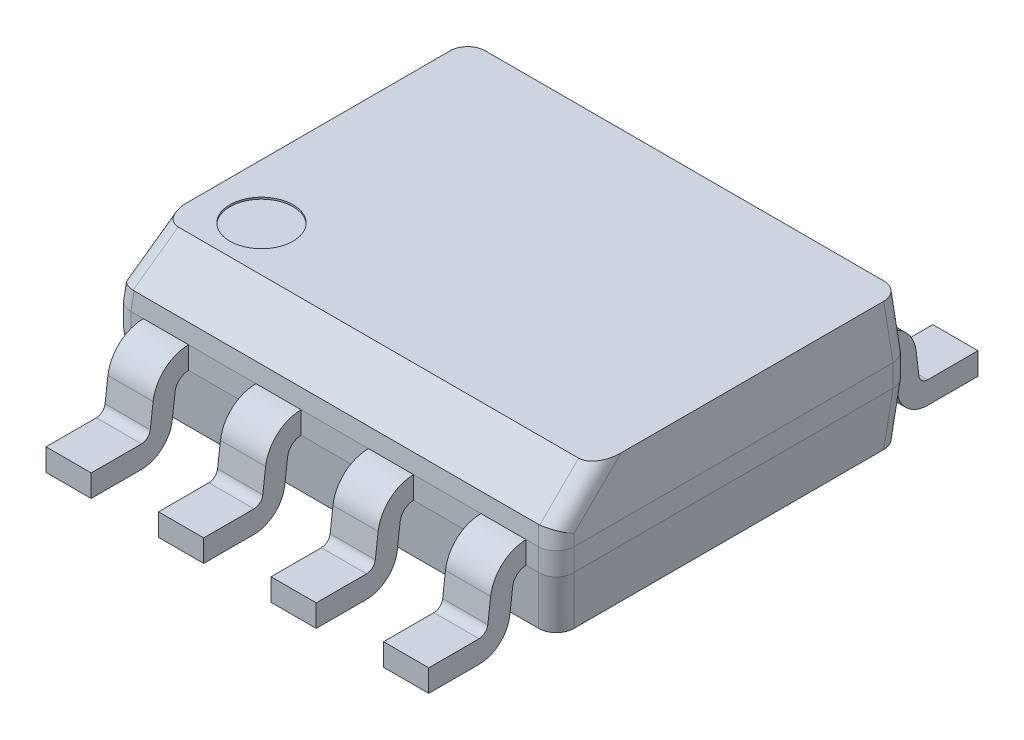
from build123d import *

# Parameters (mm, degrees)
BOSS_EXTRUDE1_DEPTH      = 0.125
BOSS_EXTRUDE1_DEPTH_BACK = 0.125
SKETCH1_W                = 5
SKETCH1_H                = 4
SKETCH2_W                = 5
SKETCH2_H                = 4
BOSS_EXTRUDE2_DEPTH      = 0.6
BOSS_EXTRUDE2_TAPER      = 5
SKETCH3_W                = 5
SKETCH3_H                = 4
BOSS_EXTRUDE3_DEPTH      = 0.6
BOSS_EXTRUDE3_TAPER      = 5
CHAMFER1_SIZE            = 0.4
CHAMFER1_SIZE2           = 0.440025147
BOSS_EXTRUDE4_START      = 0.38
BOSS_EXTRUDE4_DEPTH      = 0.51
LPATTERN1_COUNT          = 2
LPATTERN1_PITCH          = 1.27
LPATTERN1_COL_COUNT      = 3
LPATTERN1_COL_PITCH      = 1.27
SKETCH6_R                = 0.356697025
CUT_EXTRUDE1_DEPTH       = 0.02
FILLET_1_R               = 0.2
SKETCH_1_W               = 3.1
SKETCH_1_H               = 2.2
EXTRUDE_1_DEPTH          = 0.01
CUT_EXTRUDE2_DEPTH       = 0.01


with BuildPart() as part:
    # Sketch1 → Boss-Extrude1 (new, two sides: drawn at the far end of the back side and taken through both)
    with BuildSketch(Plane(origin=(0, 0.82, 0), x_dir=(1, 0, 0), z_dir=(0, 1, 0)).offset(-BOSS_EXTRUDE1_DEPTH_BACK)):
        Rectangle(SKETCH1_W, SKETCH1_H)
    extrude(amount=BOSS_EXTRUDE1_DEPTH + BOSS_EXTRUDE1_DEPTH_BACK)

    # Sketch2 → Boss-Extrude2 (add)
    with BuildSketch(Plane(origin=(0, 0.945, 0), x_dir=(1, 0, 0), z_dir=(0, 1, 0))):
        Rectangle(SKETCH2_W, SKETCH2_H)
    extrude(amount=BOSS_EXTRUDE2_DEPTH, taper=BOSS_EXTRUDE2_TAPER)

    # Sketch3 → Boss-Extrude3 (add)
    with BuildSketch(Plane.XZ.offset(-0.695)):
        Rectangle(SKETCH3_W, SKETCH3_H)
    extrude(amount=BOSS_EXTRUDE3_DEPTH, taper=BOSS_EXTRUDE3_TAPER)

    # Chamfer1
    chamfer1_edges = [part.edges().sort_by_distance(p)[0] for p in [
        (0, 1.545, 1.947506802),
    ]]
    chamfer1_side = [part.faces().sort_by_distance(p)[0] for p in [
        (0, 1.243938997, 1.973846227),
    ]]
    chamfer(chamfer1_edges, length=CHAMFER1_SIZE, length2=CHAMFER1_SIZE2, reference=chamfer1_side[0])

    # Sketch5 → Boss-Extrude4 (add)
    with BuildSketch(Plane(origin=(0, 0, 0), x_dir=(0, 0, -1), z_dir=(1, 0, 0)).offset(BOSS_EXTRUDE4_START)):
        with BuildLine():
            Line((2.43285762, 0.329963507), (2.400847843, 0.590403282))
            ThreePointArc((2.400847843, 0.590403282), (2.267590241, 0.843628667), (2, 0.945))
            Line((2, 0.945), (2, 0.695))
            ThreePointArc((2, 0.695), (2.101946488, 0.656379776), (2.152714971, 0.559906105))
            Line((2.152714971, 0.559906105), (2.184724748, 0.299466331))
            ThreePointArc((2.184724748, 0.299466331), (2.300209515, 0.080013931), (2.532110769, -0.007837622))
            Line((2.532110769, -0.007837622), (3.099630301, -0.007837622))
            Line((3.099630301, -0.007837622), (3.099630301, 0.242162378))
            Line((3.099630301, 0.242162378), (2.532110769, 0.242162378))
            ThreePointArc((2.532110769, 0.242162378), (2.465853268, 0.267262822), (2.43285762, 0.329963507))
        make_face()
        with BuildLine():
            ThreePointArc((-2.152714971, 0.559906105), (-2.101946488, 0.656379776), (-2, 0.695))
            Line((-2, 0.695), (-2, 0.945))
            ThreePointArc((-2, 0.945), (-2.267590241, 0.843628667), (-2.400847843, 0.590403282))
            Line((-2.400847843, 0.590403282), (-2.43285762, 0.329963507))
            ThreePointArc((-2.43285762, 0.329963507), (-2.465853268, 0.267262822), (-2.532110769, 0.242162378))
            Line((-2.532110769, 0.242162378), (-3.099630301, 0.242162378))
            Line((-3.099630301, 0.242162378), (-3.099630301, -0.007837622))
            Line((-3.099630301, -0.007837622), (-2.532110769, -0.007837622))
            ThreePointArc((-2.532110769, -0.007837622), (-2.300209515, 0.080013931), (-2.184724748, 0.299466331))
            Line((-2.184724748, 0.299466331), (-2.152714971, 0.559906105))
        make_face()
    boss_extrude4 = extrude(amount=BOSS_EXTRUDE4_DEPTH)

    # LPattern1: Boss-Extrude4 ×2
    with Locations(*[(i * LPATTERN1_PITCH, 0, 0) for i in range(1, LPATTERN1_COUNT)]):
        add(boss_extrude4)

    # LPattern1 col: Boss-Extrude4 ×3
    with Locations(*[(-i * LPATTERN1_COL_PITCH, 0, 0) for i in range(1, LPATTERN1_COL_COUNT)]):
        add(boss_extrude4)

    # Sketch6 → Cut-Extrude1 (cut)
    with BuildSketch(Plane(origin=(0, 1.545, 0), x_dir=(1, 0, 0), z_dir=(0, 1, 0))):
        with Locations(Location((-1.829466097, -0.997890598, 0), (0, 0, 270))):
            Circle(SKETCH6_R)
    extrude(amount=-CUT_EXTRUDE1_DEPTH, mode=Mode.SUBTRACT)

    # Скругление1
    fillet_1_edges = [part.edges().sort_by_distance(p)[0] for p in [
        (-2.33, 0.945, 2),
        (2.33, 0.695, -2),
        (2.33, 0.945, -2),
        (2.473753401, 1.245, -1.973753401),
        (-2.473753401, 1.245, -1.973753401),
        (2.473753401, 0.395, 1.973753401),
        (-2.473753401, 0.395, 1.973753401),
        (-2.473753401, 0.395, -1.973753401),
        (2.473753401, 0.395, -1.973753401),
        (2.491184549, 1.04576106, 1.991184549),
        (2.46493795, 1.34576106, 1.744925377),
        (-2.491184549, 1.04576106, 1.991184549),
        (-2.46493795, 1.34576106, 1.744925377),
        (-2.33, 0.695, 2),
        (-2.5, 0.82, -2),
        (2.5, 0.82, -2),
        (2.5, 0.82, 2),
        (-2.5, 0.82, 2),
    ]]
    fillet(fillet_1_edges, radius=FILLET_1_R)

    # Эскиз1 → Бобышка-Вытянуть1 (add)
    with BuildSketch(Plane.XZ.offset(-0.095)):
        Rectangle(SKETCH_1_W, SKETCH_1_H)
    extrude(amount=EXTRUDE_1_DEPTH)

    # Sketch7 → Cut-Extrude2 (cut)
    # profile 1 of 3: a face of its own
    with BuildSketch(Plane(origin=(0, 1.745, 0), x_dir=(1, 0, 0), z_dir=(0, 1, 0))):
        with BuildLine():
            Line((-1.226287299, -0.23455359), (-1.141752043, -0.1838725))
            add(Edge.make_bspline(
                [(-1.141752043, -0.1838725), (-1.133889689, -0.197033753), (-1.118825723, -0.222250206), (-1.093696763, -0.256323932), (-1.067658789, -0.285284548), (-1.040518979, -0.308963579), (-1.012442994, -0.327606118), (-0.98324755, -0.340806755), (-0.953031033, -0.349039891), (-0.932467084, -0.350039916), (-0.92220076, -0.350539167)],
                knots=[0, 0, 0, 0, 1.272034388, 2.437168799, 3.508375237, 4.49857839, 5.41946034, 6.295179144, 7.148887113, 8, 8, 8, 8], degree=3))
            add(Edge.make_bspline(
                [(-0.92220076, -0.350539167), (-0.913433086, -0.350294975), (-0.896051151, -0.349810863), (-0.870461939, -0.345159206), (-0.845609995, -0.338012883), (-0.822007527, -0.327778331), (-0.799980209, -0.315395907), (-0.78066401, -0.300439856), (-0.763965121, -0.283695226), (-0.750305374, -0.265014467), (-0.739825363, -0.244923854), (-0.731770487, -0.224302153), (-0.727300466, -0.202825419), (-0.726627108, -0.188365287), (-0.726287299, -0.181068013)],
                knots=[0, 0, 0, 0, 1.095163259, 2.171163733, 3.241058638, 4.321873601, 5.38011039, 6.391990106, 7.366004449, 8.327778327, 9.272591725, 10.192022065, 11.087607919, 12, 12, 12, 12], degree=3))
            add(Edge.make_bspline(
                [(-0.726287299, -0.181068013), (-0.726708531, -0.172742056), (-0.727564833, -0.155816602), (-0.734802399, -0.130845273), (-0.746187898, -0.10613311), (-0.75669151, -0.090847034), (-0.762144671, -0.082910962)],
                knots=[0, 0, 0, 0, 0.938893495, 1.908633276, 2.914225137, 4, 4, 4, 4], degree=3))
            add(Edge.make_bspline(
                [(-0.762144671, -0.082910962), (-0.766621989, -0.077183298), (-0.776021559, -0.065158784), (-0.792180848, -0.047260145), (-0.811142595, -0.02879774), (-0.832257897, -0.009066581), (-0.856295922, 0.011015647), (-0.882503783, 0.032406583), (-0.9115506, 0.054292748), (-0.931921885, 0.068970624), (-0.942433132, 0.076544166)],
                knots=[0, 0, 0, 0, 0.722233717, 1.516239348, 2.393582979, 3.351407094, 4.387010283, 5.505090956, 6.712668013, 8, 8, 8, 8], degree=3))
            add(Edge.make_bspline(
                [(-0.942433132, 0.076544166), (-0.952954274, 0.084038048), (-0.973069896, 0.098365781), (-1.001200919, 0.119629862), (-1.02635648, 0.139070967), (-1.048424771, 0.156872114), (-1.067396084, 0.173035715), (-1.083419916, 0.187406555), (-1.096088075, 0.200373286), (-1.103132527, 0.208785098), (-1.106295312, 0.212561794)],
                knots=[0, 0, 0, 0, 1.452282411, 2.77665338, 3.964542531, 5.026858415, 5.96415736, 6.766646006, 7.446254459, 8, 8, 8, 8], degree=3))
            add(Edge.make_bspline(
                [(-1.106295312, 0.212561794), (-1.110716039, 0.218447805), (-1.119409992, 0.230023435), (-1.130885994, 0.248116251), (-1.14064004, 0.266637184), (-1.148286421, 0.285636003), (-1.154725341, 0.304845982), (-1.159056178, 0.324517767), (-1.161768006, 0.344563086), (-1.162045716, 0.358052658), (-1.162184735, 0.364805384)],
                knots=[0, 0, 0, 0, 1.068054152, 2.10047183, 3.106115577, 4.101338837, 5.06977816, 6.043150881, 7.020423561, 8, 8, 8, 8], degree=3))
            add(Edge.make_bspline(
                [(-1.162184735, 0.364805384), (-1.161811818, 0.37538532), (-1.161073955, 0.396319052), (-1.154833807, 0.42689929), (-1.144984409, 0.456095409), (-1.13118587, 0.483618361), (-1.113398055, 0.508751499), (-1.092813491, 0.531783924), (-1.068295923, 0.551146376), (-1.041395174, 0.568064107), (-1.011950496, 0.581305799), (-0.981095952, 0.591294651), (-0.948782503, 0.596954439), (-0.926895893, 0.597766657), (-0.915790504, 0.598178782)],
                knots=[0, 0, 0, 0, 1.005424448, 1.989358655, 2.955360095, 3.929531133, 4.905563448, 5.876582895, 6.856512386, 7.866279853, 8.892233794, 9.918561126, 10.94386622, 12, 12, 12, 12], degree=3))
            add(Edge.make_bspline(
                [(-0.915790504, 0.598178782), (-0.904006475, 0.597772338), (-0.880571803, 0.596964052), (-0.846100599, 0.589936186), (-0.812911823, 0.578307423), (-0.786213747, 0.565110663), (-0.765318673, 0.551930259), (-0.749383606, 0.539924595), (-0.733235763, 0.526103135), (-0.71674489, 0.510429065), (-0.700190416, 0.492758565), (-0.683326573, 0.473212654), (-0.666113924, 0.45191078), (-0.655040821, 0.43670378), (-0.649364222, 0.428907948)],
                knots=[0, 0, 0, 0, 1.286793592, 2.559021753, 3.825965368, 5.121522368, 5.803751409, 6.523245864, 7.299691795, 8.125521123, 9.008227632, 9.944561021, 10.946284179, 12, 12, 12, 12], degree=3))
            Line((-0.649364222, 0.428907948), (-0.73049403, 0.367409551))
            add(Edge.make_bspline(
                [(-0.73049403, 0.367409551), (-0.735392868, 0.373720605), (-0.744826884, 0.38587422), (-0.759149594, 0.402894596), (-0.772649208, 0.418442162), (-0.785949322, 0.431946484), (-0.798347503, 0.444147094), (-0.810380943, 0.454592739), (-0.821876472, 0.463385766), (-0.836367018, 0.47276964), (-0.854572081, 0.482071498), (-0.877424805, 0.489942663), (-0.901306598, 0.494672681), (-0.917572207, 0.495298078), (-0.92580653, 0.495614679)],
                knots=[0, 0, 0, 0, 1.181633172, 2.275549214, 3.290209073, 4.226197932, 5.078386478, 5.862611352, 6.581680152, 7.217281963, 8.414376989, 9.595101626, 10.782541182, 12, 12, 12, 12], degree=3))
            add(Edge.make_bspline(
                [(-0.92580653, 0.495614679), (-0.936136965, 0.495268479), (-0.956058235, 0.494600865), (-0.98434116, 0.487309441), (-1.009796567, 0.475828909), (-1.031668729, 0.459738915), (-1.049879293, 0.440675775), (-1.063052282, 0.418738959), (-1.0709809, 0.394515415), (-1.071948409, 0.377617799), (-1.072441145, 0.369012115)],
                knots=[0, 0, 0, 0, 1.14458467, 2.207223713, 3.21896685, 4.227309161, 5.202851033, 6.127160689, 7.046193047, 8, 8, 8, 8], degree=3))
            add(Edge.make_bspline(
                [(-1.072441145, 0.369012115), (-1.072328823, 0.36365455), (-1.072103996, 0.352930658), (-1.068968339, 0.337087395), (-1.06493996, 0.321284155), (-1.05855635, 0.305591989), (-1.049743407, 0.289736457), (-1.038170499, 0.273444532), (-1.023595267, 0.256572616), (-1.012430406, 0.24559908), (-1.006535696, 0.239805384)],
                knots=[0, 0, 0, 0, 0.858281714, 1.717966888, 2.583508476, 3.4729293, 4.427298488, 5.488583878, 6.674047936, 8, 8, 8, 8], degree=3))
            add(Edge.make_bspline(
                [(-1.006535696, 0.239805384), (-1.004346733, 0.237851948), (-0.999146256, 0.233211032), (-0.989638849, 0.225613237), (-0.977083764, 0.216241016), (-0.961808849, 0.20464464), (-0.94353246, 0.191192794), (-0.922252587, 0.176057476), (-0.898206435, 0.158747345), (-0.88114303, 0.146645191), (-0.872120632, 0.140246089)],
                knots=[0, 0, 0, 0, 0.420754252, 0.999615792, 1.744751191, 2.668019286, 3.750313428, 4.999500688, 6.413464383, 8, 8, 8, 8], degree=3))
            add(Edge.make_bspline(
                [(-0.872120632, 0.140246089), (-0.861267514, 0.132348558), (-0.840251955, 0.117056083), (-0.81034979, 0.094080175), (-0.783237273, 0.071609384), (-0.758819215, 0.04978721), (-0.736854384, 0.028779184), (-0.717586464, 0.008332561), (-0.700819126, -0.011406174), (-0.682767921, -0.036712625), (-0.66432283, -0.067792934), (-0.648482399, -0.105872431), (-0.6384943, -0.144099951), (-0.637188153, -0.169793333), (-0.636543709, -0.182470257)],
                knots=[0, 0, 0, 0, 1.163667725, 2.253281268, 3.268753668, 4.215851969, 5.092017293, 5.902905408, 6.650798638, 7.335211899, 8.59617414, 9.77448103, 10.901945474, 12, 12, 12, 12], degree=3))
            add(Edge.make_bspline(
                [(-0.636543709, -0.182470257), (-0.636731463, -0.191435504), (-0.637103324, -0.209191899), (-0.641377871, -0.235264778), (-0.647640633, -0.260587884), (-0.657079842, -0.284848202), (-0.668600745, -0.308489563), (-0.683219673, -0.33089182), (-0.700164725, -0.352550791), (-0.719602944, -0.372888931), (-0.740873202, -0.391559273), (-0.763354257, -0.408167576), (-0.787082907, -0.422015669), (-0.811930426, -0.433315909), (-0.837902522, -0.442154057), (-0.86499046, -0.448557734), (-0.893238892, -0.452487937), (-0.91243903, -0.452895869), (-0.92220076, -0.45310327)],
                knots=[0, 0, 0, 0, 0.983748083, 1.948392443, 2.894712957, 3.844097841, 4.80183111, 5.778335162, 6.776009319, 7.81870978, 8.863265674, 9.881300176, 10.883814829, 11.87499822, 12.874611388, 13.892143829, 14.928324115, 16, 16, 16, 16], degree=3))
            add(Edge.make_bspline(
                [(-0.92220076, -0.45310327), (-0.929753716, -0.452957218), (-0.944764504, -0.452666953), (-0.966967213, -0.450100873), (-0.988721382, -0.446470272), (-1.009754034, -0.440706252), (-1.030336151, -0.43371283), (-1.050378218, -0.425101878), (-1.069889948, -0.414782678), (-1.088980686, -0.402984099), (-1.107601879, -0.389253315), (-1.125578869, -0.373260887), (-1.143501494, -0.355447886), (-1.16084075, -0.335330582), (-1.177947363, -0.313233987), (-1.194484051, -0.288951363), (-1.210793113, -0.262614976), (-1.221026104, -0.244082095), (-1.226287299, -0.23455359)],
                knots=[0, 0, 0, 0, 0.915332311, 1.819136955, 2.706846663, 3.586547465, 4.459518054, 5.340707479, 6.227863349, 7.133153174, 8.059268498, 9.028702269, 10.047606654, 11.120612155, 12.245963614, 13.433783089, 14.680604001, 16, 16, 16, 16], degree=3))
        make_face()
    # profile 2 of 3: a face of its own
    with BuildSketch(Plane(origin=(0, 1.745, 0), x_dir=(1, 0, 0), z_dir=(0, 1, 0))):
        with BuildLine():
            add(Edge.make_bspline(
                [(0.036533214, 0.598178782), (0.055049816, 0.597709788), (0.091417949, 0.596788644), (0.14486792, 0.589737472), (0.19589509, 0.577538789), (0.24491513, 0.561292223), (0.291341694, 0.539619541), (0.335524235, 0.513423784), (0.377357627, 0.482430511), (0.416278022, 0.446879303), (0.451894294, 0.408198316), (0.483273118, 0.366918913), (0.509570917, 0.323290684), (0.531166856, 0.277444732), (0.548109316, 0.229484741), (0.559800471, 0.179155026), (0.567268514, 0.126781686), (0.568141593, 0.091059725), (0.568584496, 0.072938397)],
                knots=[0, 0, 0, 0, 1.065120563, 2.091984664, 3.0946048, 4.079830382, 5.057816894, 6.036188127, 7.030412546, 8.04752943, 9.064399622, 10.05169764, 11.02544977, 11.989514704, 12.962713494, 13.945757189, 14.957906945, 16, 16, 16, 16], degree=3))
            add(Edge.make_bspline(
                [(0.568584496, 0.072938397), (0.568141658, 0.054950555), (0.567268773, 0.019494435), (0.55979198, -0.032546549), (0.54806598, -0.082572462), (0.531324189, -0.130499792), (0.509831196, -0.176379096), (0.48335829, -0.220089654), (0.452175086, -0.261645796), (0.416687415, -0.300592272), (0.378001403, -0.336305835), (0.336507041, -0.367425514), (0.293137521, -0.394203835), (0.247334747, -0.415570599), (0.199706165, -0.432648291), (0.149825501, -0.444291899), (0.097926486, -0.451802483), (0.062534771, -0.452664916), (0.044546034, -0.45310327)],
                knots=[0, 0, 0, 0, 1.043624062, 2.057103931, 3.04512605, 4.022047818, 4.998200453, 5.980619268, 6.982898556, 8.009068085, 9.034988726, 10.034168286, 11.015286542, 11.987931943, 12.962482838, 13.94673481, 14.956375938, 16, 16, 16, 16], degree=3))
            add(Edge.make_bspline(
                [(0.044546034, -0.45310327), (0.0264248, -0.452660588), (-0.009296976, -0.451787944), (-0.061736129, -0.444307542), (-0.112101198, -0.432610027), (-0.160248156, -0.415893045), (-0.20620385, -0.394288122), (-0.250058159, -0.367944014), (-0.291635058, -0.336684831), (-0.330589843, -0.301208666), (-0.366232471, -0.262588223), (-0.397306579, -0.221207007), (-0.423656611, -0.177876877), (-0.445188992, -0.132477584), (-0.46223598, -0.085228601), (-0.473865928, -0.03581475), (-0.481390486, 0.015482252), (-0.482257585, 0.050408794), (-0.482697555, 0.068130705)],
                knots=[0, 0, 0, 0, 1.053102029, 2.075944431, 3.073151272, 4.055350789, 5.033113405, 6.020478099, 7.024410459, 8.052272461, 9.079885166, 10.07527673, 11.055994387, 12.023226415, 12.992069828, 13.970394897, 14.97016774, 16, 16, 16, 16], degree=3))
            add(Edge.make_bspline(
                [(-0.482697555, 0.068130705), (-0.482544802, 0.080025753), (-0.482241223, 0.103665788), (-0.478586454, 0.138770531), (-0.473283111, 0.173310719), (-0.465682564, 0.207188133), (-0.455742088, 0.240319843), (-0.444012937, 0.272934346), (-0.429687267, 0.304701125), (-0.413492797, 0.335770665), (-0.395417994, 0.365658638), (-0.375453494, 0.393909948), (-0.354300532, 0.420761661), (-0.331110991, 0.445517948), (-0.306649149, 0.468898993), (-0.280518184, 0.490545483), (-0.252877543, 0.510652612), (-0.223608292, 0.528772709), (-0.193431642, 0.545161034), (-0.162323991, 0.55922442), (-0.130707828, 0.571294723), (-0.098435071, 0.581077816), (-0.065591422, 0.588801255), (-0.032105198, 0.594060499), (0.001996924, 0.597724589), (0.024971587, 0.598026733), (0.036533214, 0.598178782)],
                knots=[0, 0, 0, 0, 1.037015668, 2.060948919, 3.074880161, 4.083647147, 5.086022904, 6.090072063, 7.104153813, 8.122640571, 9.144368836, 10.147691507, 11.138137339, 12.123020368, 13.103399296, 14.087645067, 15.080126199, 16.082011238, 17.087798457, 18.072939717, 19.057185487, 20.037253025, 21.01195951, 21.997135196, 22.992090687, 24, 24, 24, 24], degree=3))
        make_face()
        with BuildLine():
            add(Edge.make_bspline(
                [(0.040940265, 0.495614679), (0.03145037, 0.495498996), (0.012561303, 0.495268736), (-0.015519993, 0.492235675), (-0.043231974, 0.487912849), (-0.070580363, 0.4817467), (-0.097450731, 0.473345542), (-0.124093543, 0.463676712), (-0.150265844, 0.451899257), (-0.175881232, 0.43859277), (-0.200714111, 0.423864507), (-0.224146311, 0.407586859), (-0.246238495, 0.390141558), (-0.266936571, 0.37148789), (-0.286179764, 0.351530861), (-0.304346821, 0.330573022), (-0.320709559, 0.308015339), (-0.335705438, 0.284469509), (-0.349124821, 0.2599662), (-0.361057779, 0.234763382), (-0.370818925, 0.208655471), (-0.378779604, 0.181925712), (-0.385379549, 0.154616438), (-0.389560671, 0.126520481), (-0.392627059, 0.097779021), (-0.392844158, 0.078355634), (-0.392953966, 0.068531346)],
                knots=[0, 0, 0, 0, 1.008559885, 2.007477868, 2.99961109, 3.989939068, 4.984837346, 5.991145699, 7.001802488, 8.033829008, 9.059044045, 10.069351652, 11.065060232, 12.050310815, 13.029377138, 14.011219647, 14.996725999, 15.989392538, 16.977580475, 17.965360261, 18.951710183, 19.937753436, 20.929683414, 21.935841486, 22.955955122, 24, 24, 24, 24], degree=3))
            add(Edge.make_bspline(
                [(-0.392953966, 0.068531346), (-0.392589719, 0.054084997), (-0.391873134, 0.02566456), (-0.385599543, -0.015983481), (-0.375936121, -0.056008706), (-0.36169116, -0.094192109), (-0.343876698, -0.130861904), (-0.321869015, -0.165692791), (-0.295794991, -0.198694184), (-0.26617684, -0.229635689), (-0.233798924, -0.257877347), (-0.199418144, -0.282666893), (-0.163402828, -0.30364125), (-0.125659056, -0.320728413), (-0.08638833, -0.334268338), (-0.045337601, -0.343547947), (-0.002780327, -0.34965522), (0.026228431, -0.350241722), (0.040940265, -0.350539167)],
                knots=[0, 0, 0, 0, 1.032063989, 2.030389145, 3.003944642, 3.970395727, 4.937377036, 5.913328081, 6.909231446, 7.93887556, 8.970685674, 9.976071282, 10.964166581, 11.944589148, 12.933237628, 13.927779006, 14.949070134, 16, 16, 16, 16], degree=3))
            add(Edge.make_bspline(
                [(0.040940265, -0.350539167), (0.050828694, -0.350403309), (0.070440419, -0.350133861), (0.099610568, -0.347419953), (0.1282552, -0.34306799), (0.156334137, -0.336802089), (0.183815512, -0.32896003), (0.210814027, -0.319643536), (0.23704211, -0.308020335), (0.262830635, -0.295178063), (0.287515276, -0.280538018), (0.311079713, -0.264812832), (0.332929993, -0.247393227), (0.353612585, -0.229016709), (0.372934782, -0.209312752), (0.39076592, -0.188306975), (0.407045958, -0.165866787), (0.422036143, -0.142356671), (0.435408504, -0.117786313), (0.447059675, -0.092492119), (0.456944279, -0.066536374), (0.464923852, -0.039881639), (0.471176841, -0.012578539), (0.47548539, 0.015409483), (0.478499229, 0.044026438), (0.478726394, 0.063381825), (0.478840906, 0.073138718)],
                knots=[0, 0, 0, 0, 1.047197238, 2.076906641, 3.100256066, 4.114471768, 5.12198147, 6.126382909, 7.136867548, 8.15857795, 9.17633901, 10.174870724, 11.156907918, 12.133735059, 13.104061851, 14.077631395, 15.04955518, 16.038496417, 17.029181396, 18.010275684, 18.986308667, 19.968651475, 20.955262928, 21.950658345, 22.966943676, 24, 24, 24, 24], degree=3))
            add(Edge.make_bspline(
                [(0.478840906, 0.073138718), (0.478726302, 0.082828862), (0.478498965, 0.102051047), (0.475486829, 0.130468424), (0.471172289, 0.158255056), (0.464954373, 0.185301857), (0.456940043, 0.211615721), (0.447057949, 0.237171935), (0.435405006, 0.262065705), (0.422031227, 0.286235504), (0.406998135, 0.309428286), (0.390571208, 0.331600404), (0.372466823, 0.352335473), (0.353202245, 0.372145386), (0.332296277, 0.39060764), (0.309843622, 0.40772836), (0.286116857, 0.423920724), (0.26099479, 0.438528027), (0.235067946, 0.452017808), (0.208463958, 0.463575238), (0.181484215, 0.473395843), (0.154197326, 0.481772119), (0.126373618, 0.487888699), (0.098201095, 0.49223957), (0.069718736, 0.495267681), (0.05056353, 0.495498646), (0.040940265, 0.495614679)],
                knots=[0, 0, 0, 0, 1.02996197, 2.043119294, 3.035359645, 4.018872909, 4.991431989, 5.957985074, 6.929999688, 7.912076566, 8.892894881, 9.867085534, 10.843653904, 11.817741046, 12.803660682, 13.806313499, 14.818574707, 15.856120519, 16.894564902, 17.924820532, 18.937903209, 19.946497019, 20.957711757, 21.963978472, 22.977135795, 24, 24, 24, 24], degree=3))
        make_face(mode=Mode.SUBTRACT)
    # profile 3 of 3: a face of its own
    with BuildSketch(Plane(origin=(0, 1.745, 0), x_dir=(1, 0, 0), z_dir=(0, 1, 0))):
        with BuildLine():
            add(Edge.make_bspline(
                [(1.170146996, 0.129629102), (1.178332295, 0.125361115), (1.194296362, 0.117037114), (1.217032707, 0.10363402), (1.237811279, 0.08950803), (1.257208583, 0.075326356), (1.274883826, 0.060545884), (1.290639372, 0.04510784), (1.304864406, 0.02939757), (1.317272059, 0.013149044), (1.328185441, -0.00359457), (1.33761748, -0.02087722), (1.345679537, -0.038661029), (1.352068949, -0.057140123), (1.357332318, -0.076043055), (1.360953919, -0.095613907), (1.36290161, -0.115723719), (1.363269842, -0.129314662), (1.363456291, -0.136196218)],
                knots=[0, 0, 0, 0, 1.272397273, 2.481599622, 3.635517121, 4.734568067, 5.792894095, 6.808321871, 7.773003508, 8.711915296, 9.623354172, 10.525449501, 11.423591555, 12.311487226, 13.218079475, 14.126165749, 15.051214107, 16, 16, 16, 16], degree=3))
            add(Edge.make_bspline(
                [(1.363456291, -0.136196218), (1.363235885, -0.145824142), (1.362799619, -0.164881415), (1.358999624, -0.193008876), (1.353310201, -0.220326528), (1.345001769, -0.246828382), (1.334226515, -0.272368203), (1.320947419, -0.296967853), (1.305915646, -0.321030513), (1.293843577, -0.335836056), (1.287735137, -0.343327629)],
                knots=[0, 0, 0, 0, 1.025265484, 2.029385089, 3.018602448, 3.995076438, 4.983346944, 5.966715145, 6.97116228, 8, 8, 8, 8], degree=3))
            add(Edge.make_bspline(
                [(1.287735137, -0.343327629), (1.279781859, -0.352068707), (1.263973583, -0.369442848), (1.236892746, -0.392000222), (1.207172208, -0.410957192), (1.17492697, -0.426406304), (1.140243227, -0.438430836), (1.103128368, -0.447071555), (1.063510039, -0.45202082), (1.036279904, -0.452736246), (1.022310457, -0.45310327)],
                knots=[0, 0, 0, 0, 0.954267603, 1.896743057, 2.838368354, 3.796610408, 4.779680527, 5.799409237, 6.871065594, 8, 8, 8, 8], degree=3))
            add(Edge.make_bspline(
                [(1.022310457, -0.45310327), (1.008878061, -0.45277399), (0.982739981, -0.452133246), (0.944694873, -0.44779198), (0.909231139, -0.440184018), (0.876142577, -0.429771272), (0.845628664, -0.416225493), (0.81777635, -0.399365947), (0.792183786, -0.37987125), (0.769627651, -0.357181513), (0.749602381, -0.332879264), (0.732011509, -0.307807375), (0.717390343, -0.281963559), (0.705011173, -0.255733168), (0.695534595, -0.228748553), (0.688971107, -0.201148549), (0.684802731, -0.172981365), (0.684248121, -0.153972322), (0.683969111, -0.144409359)],
                knots=[0, 0, 0, 0, 1.256902934, 2.445805442, 3.576955095, 4.645999104, 5.686449165, 6.692658513, 7.68621702, 8.689161843, 9.678783111, 10.630372946, 11.551080876, 12.453998257, 13.34127905, 14.221779781, 15.105423033, 16, 16, 16, 16], degree=3))
            add(Edge.make_bspline(
                [(0.683969111, -0.144409359), (0.68413422, -0.137392447), (0.684460534, -0.123524553), (0.686719062, -0.103036173), (0.690350051, -0.08309442), (0.695281324, -0.063625636), (0.701964474, -0.044771558), (0.710033655, -0.026442852), (0.719442785, -0.008618823), (0.730323117, 0.008798), (0.742980839, 0.025563575), (0.75731331, 0.04196243), (0.773606987, 0.057740107), (0.791680604, 0.073089371), (0.811327615, 0.088282506), (0.833058338, 0.102498429), (0.8562967, 0.116743561), (0.87281253, 0.125260226), (0.881284816, 0.129629102)],
                knots=[0, 0, 0, 0, 0.941657376, 1.861047343, 2.762797495, 3.66048619, 4.553285746, 5.444104102, 6.34607688, 7.256116206, 8.197091036, 9.162375105, 10.176350973, 11.237807142, 12.343728897, 13.50695164, 14.721116704, 16, 16, 16, 16], degree=3))
            add(Edge.make_bspline(
                [(0.881284816, 0.129629102), (0.869687281, 0.135953322), (0.847231206, 0.148198781), (0.81749708, 0.170697869), (0.791956902, 0.195065816), (0.771312697, 0.221817186), (0.755063489, 0.250116293), (0.743915316, 0.279786079), (0.736373463, 0.310276397), (0.73562637, 0.331106739), (0.735251163, 0.341568205)],
                knots=[0, 0, 0, 0, 1.166880483, 2.259407225, 3.286803203, 4.280235371, 5.237608625, 6.161067461, 7.076446754, 8, 8, 8, 8], degree=3))
            add(Edge.make_bspline(
                [(0.735251163, 0.341568205), (0.735718427, 0.35222465), (0.736657709, 0.373645963), (0.744252943, 0.405533427), (0.756630105, 0.436852446), (0.773464676, 0.467451221), (0.794432452, 0.496294139), (0.819588608, 0.522162981), (0.848332407, 0.544823405), (0.880520369, 0.563845168), (0.915159293, 0.579326214), (0.951706643, 0.590005763), (0.989525641, 0.596987511), (1.015267847, 0.597777983), (1.028320073, 0.598178782)],
                knots=[0, 0, 0, 0, 0.888701115, 1.786444228, 2.72001202, 3.692817113, 4.693886446, 5.687152267, 6.695133018, 7.739871481, 8.800368666, 9.853104506, 10.91144658, 12, 12, 12, 12], degree=3))
            add(Edge.make_bspline(
                [(1.028320073, 0.598178782), (1.041035449, 0.597765541), (1.066108721, 0.596950677), (1.102964329, 0.590154426), (1.138228579, 0.578803135), (1.171779865, 0.563403928), (1.203017541, 0.544436231), (1.230618201, 0.521464552), (1.254998939, 0.495709823), (1.275165909, 0.466875651), (1.291783877, 0.436394453), (1.303355563, 0.404502304), (1.310770413, 0.371888287), (1.31170566, 0.349820286), (1.31217424, 0.338763718)],
                knots=[0, 0, 0, 0, 1.072916533, 2.115669174, 3.151510826, 4.193348718, 5.225979165, 6.227137561, 7.216255879, 8.211077061, 9.189680878, 10.138522389, 11.067357538, 12, 12, 12, 12], degree=3))
            add(Edge.make_bspline(
                [(1.31217424, 0.338763718), (1.311764365, 0.327913242), (1.310959395, 0.306603525), (1.304187984, 0.275538805), (1.29278418, 0.246446794), (1.277214419, 0.218997379), (1.256921422, 0.19368838), (1.23217607, 0.17019796), (1.203175648, 0.148333152), (1.181386823, 0.13599419), (1.170146996, 0.129629102)],
                knots=[0, 0, 0, 0, 0.975232327, 1.915300861, 2.843280834, 3.77672583, 4.742871857, 5.749627742, 6.839139064, 8, 8, 8, 8], degree=3))
        make_face()
        with BuildLine():
            add(Edge.make_bspline(
                [(1.02331206, 0.495614679), (1.016297544, 0.495428553), (1.002574084, 0.49506441), (0.982451606, 0.493161942), (0.963316644, 0.489461023), (0.944969273, 0.484535677), (0.927661041, 0.477881966), (0.911156882, 0.47005482), (0.895737685, 0.460538802), (0.881217313, 0.449864174), (0.868145663, 0.438123343), (0.856544362, 0.425890852), (0.846907758, 0.412926454), (0.838724584, 0.399552637), (0.832787008, 0.385372473), (0.828340064, 0.370820708), (0.825333952, 0.355713455), (0.825108698, 0.345388738), (0.824994752, 0.340165961)],
                knots=[0, 0, 0, 0, 1.203892937, 2.355340988, 3.463153438, 4.544400666, 5.610487187, 6.640501085, 7.674077295, 8.714426146, 9.728707835, 10.68524104, 11.601827946, 12.495867327, 13.368432065, 14.231010473, 15.105153427, 16, 16, 16, 16], degree=3))
            add(Edge.make_bspline(
                [(0.824994752, 0.340165961), (0.825191143, 0.334942958), (0.825579239, 0.324621555), (0.828580704, 0.309379879), (0.833054091, 0.294402268), (0.840097137, 0.280044865), (0.848544668, 0.26580962), (0.858970804, 0.252052309), (0.871396241, 0.238725056), (0.885404081, 0.225941216), (0.90066452, 0.213970141), (0.91683139, 0.203577803), (0.933701787, 0.194882343), (0.951102378, 0.18764537), (0.969210506, 0.182019674), (0.987915213, 0.178028632), (1.007219642, 0.175548062), (1.020299808, 0.17525177), (1.026917829, 0.175101859)],
                knots=[0, 0, 0, 0, 0.873023192, 1.725219244, 2.590779336, 3.480155217, 4.391973325, 5.357036234, 6.360879153, 7.436073238, 8.526419356, 9.601555421, 10.645666583, 11.697338044, 12.750135903, 13.812665442, 14.89329948, 16, 16, 16, 16], degree=3))
            add(Edge.make_bspline(
                [(1.026917829, 0.175101859), (1.035417859, 0.175351249), (1.052333964, 0.175847567), (1.077270916, 0.180462188), (1.101517386, 0.187721022), (1.124814216, 0.197652441), (1.146558383, 0.210117544), (1.165941259, 0.225041263), (1.182797514, 0.242079005), (1.196951975, 0.26096553), (1.207926216, 0.281065983), (1.21646959, 0.301237496), (1.221458509, 0.321695276), (1.222109242, 0.335400123), (1.22243065, 0.342169166)],
                knots=[0, 0, 0, 0, 1.076279235, 2.141928126, 3.20205304, 4.278698113, 5.344010996, 6.36967002, 7.368914609, 8.37248503, 9.349703398, 10.264243087, 11.142681841, 12, 12, 12, 12], degree=3))
            add(Edge.make_bspline(
                [(1.22243065, 0.342169166), (1.222278679, 0.346920034), (1.221977039, 0.356349825), (1.219491309, 0.370275072), (1.215383928, 0.383883524), (1.209823048, 0.397287602), (1.202505964, 0.410299239), (1.193830481, 0.423122979), (1.183292052, 0.43547034), (1.1714645, 0.447629068), (1.158051526, 0.458881646), (1.14307898, 0.468777278), (1.126623623, 0.477180808), (1.108685065, 0.484006167), (1.089329373, 0.489132552), (1.068645694, 0.492971509), (1.046461567, 0.495135255), (1.031195924, 0.495451405), (1.02331206, 0.495614679)],
                knots=[0, 0, 0, 0, 0.814439003, 1.616544685, 2.417341072, 3.248991801, 4.09997495, 4.973547432, 5.9003056, 6.880240646, 7.880314356, 8.896779544, 9.951930927, 11.043077905, 12.18215768, 13.381699519, 14.647792085, 16, 16, 16, 16], degree=3))
        make_face(mode=Mode.SUBTRACT)
        with BuildLine():
            add(Edge.make_bspline(
                [(1.029121355, 0.072537756), (1.020228273, 0.072379573), (1.002782217, 0.072069256), (0.977223095, 0.068615113), (0.952693619, 0.063806715), (0.929276494, 0.05651219), (0.90698161, 0.047027478), (0.885688272, 0.035617609), (0.865559377, 0.02213034), (0.846872884, 0.006737021), (0.829809076, -0.009851394), (0.814838133, -0.027412004), (0.802124556, -0.045618442), (0.791886484, -0.064701936), (0.783483132, -0.084258396), (0.777964881, -0.104774852), (0.774427249, -0.125856885), (0.773952212, -0.140188341), (0.773712701, -0.147414167)],
                knots=[0, 0, 0, 0, 1.140299081, 2.23698856, 3.303958914, 4.344563908, 5.37730929, 6.408454204, 7.439741482, 8.480804886, 9.510774543, 10.48932336, 11.43758569, 12.353841022, 13.263987381, 14.161954604, 15.073269652, 16, 16, 16, 16], degree=3))
            add(Edge.make_bspline(
                [(0.773712701, -0.147414167), (0.774102204, -0.156394426), (0.774874967, -0.17421105), (0.781005436, -0.200543356), (0.79084416, -0.226035086), (0.80456565, -0.250478501), (0.821556385, -0.273321388), (0.842449662, -0.293232467), (0.865947044, -0.310924318), (0.892843574, -0.325233042), (0.922223136, -0.336660143), (0.954077915, -0.344533276), (0.987950749, -0.349745118), (1.011339204, -0.350270313), (1.02331206, -0.350539167)],
                knots=[0, 0, 0, 0, 0.898778495, 1.783155532, 2.693654817, 3.627872908, 4.583023416, 5.533784346, 6.509005473, 7.520592997, 8.575161974, 9.658835044, 10.801527049, 12, 12, 12, 12], degree=3))
            add(Edge.make_bspline(
                [(1.02331206, -0.350539167), (1.032669308, -0.350359508), (1.050900228, -0.350009473), (1.077496213, -0.346919675), (1.102594656, -0.342019782), (1.126146884, -0.334893055), (1.148416552, -0.326193061), (1.169026082, -0.315001038), (1.188505661, -0.302271803), (1.20589541, -0.287169472), (1.22173347, -0.271032474), (1.235542982, -0.253949604), (1.247530854, -0.236385138), (1.256939699, -0.217942142), (1.264461485, -0.198974453), (1.269868215, -0.179307164), (1.273204277, -0.158879954), (1.273541676, -0.145023077), (1.273712701, -0.137999103)],
                knots=[0, 0, 0, 0, 1.224942928, 2.386581632, 3.501229538, 4.569074225, 5.605009692, 6.626002462, 7.634866581, 8.645888296, 9.63523824, 10.59253846, 11.518950513, 12.414518923, 13.29783783, 14.186679152, 15.080837789, 16, 16, 16, 16], degree=3))
            add(Edge.make_bspline(
                [(1.273712701, -0.137999103), (1.273453887, -0.131177006), (1.272943551, -0.117725021), (1.269704497, -0.097791728), (1.264014246, -0.078533781), (1.256206419, -0.059719494), (1.245811858, -0.041730079), (1.233570466, -0.024096888), (1.218800718, -0.007309332), (1.202111405, 0.008762981), (1.18392313, 0.02362462), (1.16458966, 0.036771603), (1.144259814, 0.047843636), (1.122976611, 0.056848349), (1.100787309, 0.063930483), (1.07770823, 0.06887791), (1.053712351, 0.071992083), (1.03741096, 0.07235381), (1.029121355, 0.072537756)],
                knots=[0, 0, 0, 0, 0.917430815, 1.809013306, 2.70690318, 3.612392954, 4.541220862, 5.495268465, 6.494511384, 7.542276156, 8.608045339, 9.649016899, 10.681629292, 11.715607085, 12.752076957, 13.808767841, 14.885711793, 16, 16, 16, 16], degree=3))
        make_face(mode=Mode.SUBTRACT)
    extrude(amount=-CUT_EXTRUDE2_DEPTH, mode=Mode.SUBTRACT)


solid = part.part
